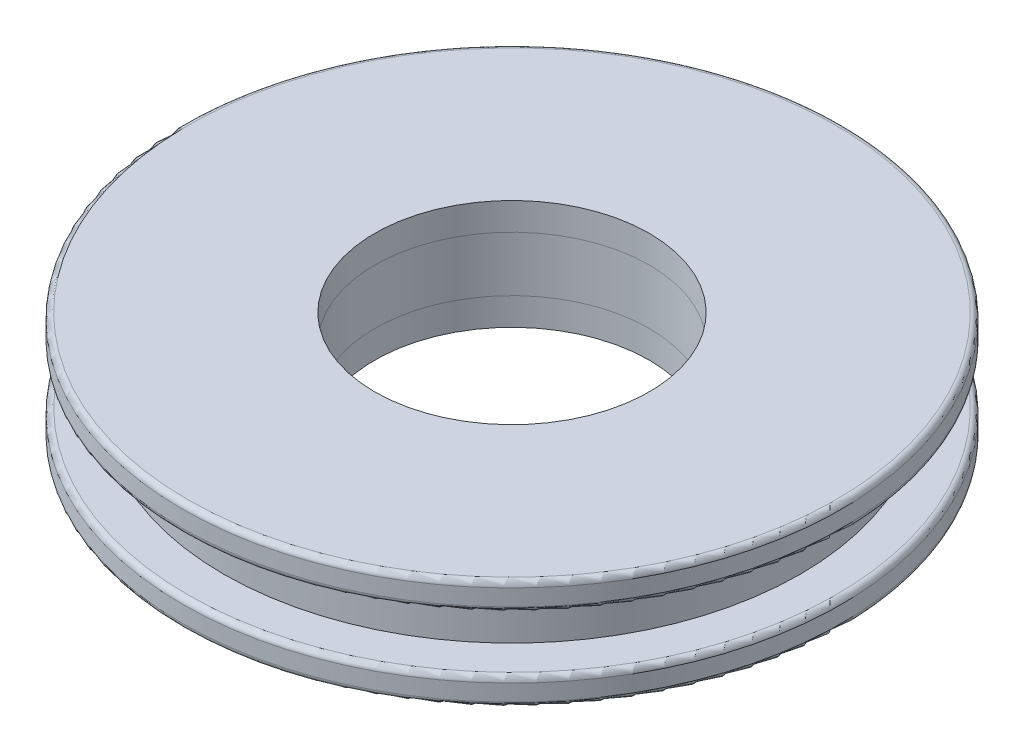
from build123d import *

# Parameters (mm, degrees)
SKETCH_1_R      = 12
SKETCH_1_R_2    = 5
EXTRUDE_1_DEPTH = 1
SKETCH_3_R      = 12
SKETCH_3_R_2    = 5
EXTRUDE_2_DEPTH = 2
SKETCH_4_R      = 12
SKETCH_4_R_2    = 5
EXTRUDE_3_DEPTH = 1
SKETCH_5_W      = 3
SKETCH_5_H      = 2
FILLET_1_R      = 0.2
FILLET_2_R      = 0.2
FILLET_3_R      = 0.2
FILLET_4_R      = 0.2


with BuildPart() as part:
    # 草图1 → 凸台-拉伸1 (new body)
    with BuildSketch(Plane(origin=(0, 0, 0), x_dir=(1, 0, 0), z_dir=(0, 1, 0))):
        with Locations(Location((0, 0, 0), (0, 0, 270))):
            Circle(SKETCH_1_R)
        with Locations(Location((0, 0, 0), (0, 0, 270))):
            Circle(SKETCH_1_R_2, mode=Mode.SUBTRACT)
    extrude(amount=EXTRUDE_1_DEPTH)

    # 圆角3
    fillet_3_edges = [part.edges().sort_by_distance(p)[0] for p in [
        (0, 1, -12),
    ]]
    fillet(fillet_3_edges, radius=FILLET_3_R)

    # 圆角4
    fillet_4_edges = [part.edges().sort_by_distance(p)[0] for p in [
        (0, 0, -12),
    ]]
    fillet(fillet_4_edges, radius=FILLET_4_R)


with BuildPart() as body_2:
    # 草图3 → 凸台-拉伸2 (new body)
    with BuildSketch(Plane(origin=(0, 1, 0), x_dir=(1, 0, 0), z_dir=(0, 1, 0))):
        with Locations(Location((0, 0, 0), (0, 0, 270))):
            Circle(SKETCH_3_R)
        with Locations(Location((0, 0, 0), (0, 0, 270))):
            Circle(SKETCH_3_R_2, mode=Mode.SUBTRACT)
    extrude(amount=EXTRUDE_2_DEPTH)

    # 草图5 → 切除-旋转1 (revolve, cut)
    with BuildSketch(Plane(origin=(0, 0, 0), x_dir=(0, 0, -1), z_dir=(1, 0, 0)), mode=Mode.PRIVATE) as cut_revolve_1_sk:
        with Locations((12, 2)):
            Rectangle(SKETCH_5_W, SKETCH_5_H)
    revolve(cut_revolve_1_sk.sketch.rotate(Axis((0, 3, 0), (0, -1, 0)), 180), axis=Axis((0, 3, 0), (0, -1, 0)), mode=Mode.SUBTRACT)


with BuildPart() as body_3:
    # 草图4 → 凸台-拉伸3 (new body)
    with BuildSketch(Plane(origin=(0, 3, 0), x_dir=(1, 0, 0), z_dir=(0, 1, 0))):
        with Locations(Location((0, 0, 0), (0, 0, 270))):
            Circle(SKETCH_4_R)
        with Locations(Location((0, 0, 0), (0, 0, 270))):
            Circle(SKETCH_4_R_2, mode=Mode.SUBTRACT)
    extrude(amount=EXTRUDE_3_DEPTH)

    # 圆角1
    fillet_1_edges = [body_3.edges().sort_by_distance(p)[0] for p in [
        (0, 4, -12),
    ]]
    fillet(fillet_1_edges, radius=FILLET_1_R)

    # 圆角2
    fillet_2_edges = [body_3.edges().sort_by_distance(p)[0] for p in [
        (0, 3, -12),
    ]]
    fillet(fillet_2_edges, radius=FILLET_2_R)


solid = Compound([part.part, body_2.part, body_3.part])
